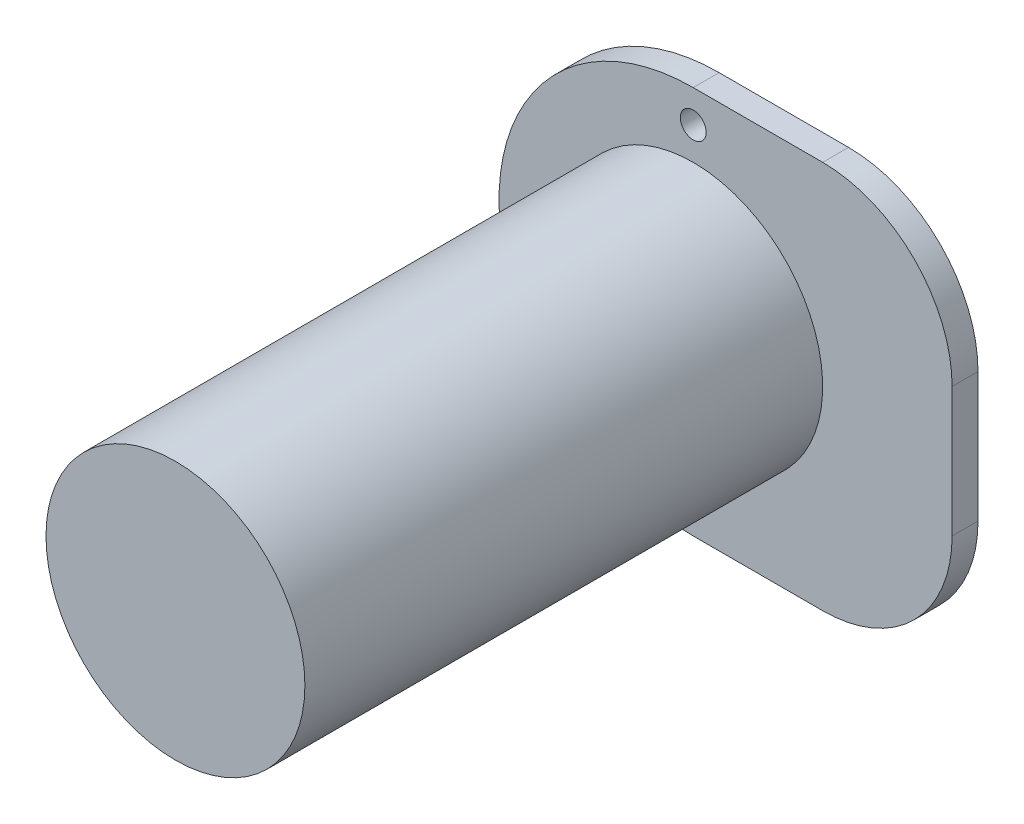
from build123d import *

# Parameters (mm, degrees)
SKETCH1_R           = 50
BOSS_EXTRUDE1_DEPTH = 105
BOSS_EXTRUDE3_START = -10
SKETCH2_R           = 50
SKETCH2_W           = 100
SKETCH2_H           = 150
BOSS_EXTRUDE3_DEPTH = 10
SKETCH3_R           = 5
CUT_EXTRUDE1_DEPTH  = 10
FILLET1_R           = 50


with BuildPart() as part:
    # Sketch1 → Boss-Extrude1 (new, symmetric)
    with BuildSketch(Plane.XY):
        Circle(SKETCH1_R)
    extrude(amount=BOSS_EXTRUDE1_DEPTH, both=True)

    # Sketch2 → Boss-Extrude3 (add)
    with BuildSketch(Plane(origin=(0, 0, -105), x_dir=(-1, 0, 0), z_dir=(0, 0, -1)).offset(BOSS_EXTRUDE3_START)):
        Circle(SKETCH2_R)
        with BuildLine():
            Line((0, 75), (0, -75))
            ThreePointArc((0, -75), (75, 0), (0, 75))
        make_face()
        with Locations((-50, 0)):
            Rectangle(SKETCH2_W, SKETCH2_H)
    extrude(amount=BOSS_EXTRUDE3_DEPTH)

    # Sketch3 → Cut-Extrude1 (cut)
    with BuildSketch(Plane(origin=(0, 0, -105), x_dir=(-1, 0, 0), z_dir=(0, 0, -1))):
        with Locations((0, 62.5)):
            Circle(SKETCH3_R)
        with Locations((62.5, 0)):
            Circle(SKETCH3_R)
        with Locations((0, -62.5)):
            Circle(SKETCH3_R)
    extrude(amount=-CUT_EXTRUDE1_DEPTH, mode=Mode.SUBTRACT)

    # Fillet1
    fillet1_edges = [part.edges().sort_by_distance(p)[0] for p in [
        (100, -75, -100),
        (100, 75, -100),
    ]]
    fillet(fillet1_edges, radius=FILLET1_R)


solid = part.part
